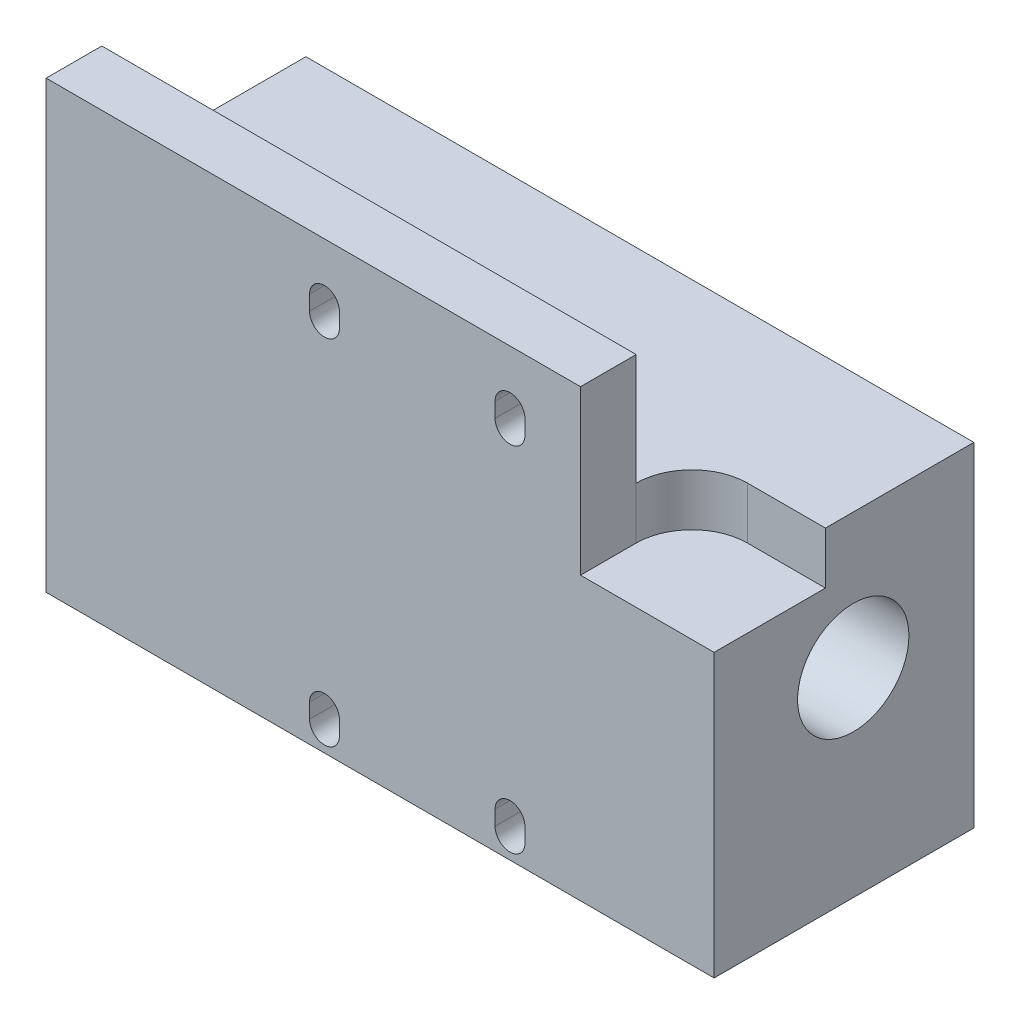
from build123d import *

# Parameters (mm, degrees)
SKETCH1_W              = 44.45
SKETCH1_H              = 76.2
BOSS_EXTRUDE1_DEPTH    = 114.3
CUT_EXTRUDE1_REACH     = 124.516
SKETCH2_R              = 9.525
SKETCH3_W              = 22.86
SKETCH3_H              = 27.94
CUT_EXTRUDE2_DEPTH     = 19.05
CUT_EXTRUDE3_REACH     = 124.516
SKETCH4_W              = 34.925
SKETCH4_H              = 19.05
FILLET1_R              = 9.525
F_10_CLEARANCE_HOLE1_D = 5.1054
CUT_EXTRUDE4_REACH     = 130.421


with BuildPart() as part:
    # Sketch1 → Boss-Extrude1 (new body)
    with BuildSketch(Plane(origin=(0, 0, 0), x_dir=(0, 0, -1), z_dir=(1, 0, 0))):
        Rectangle(SKETCH1_W, SKETCH1_H)
    extrude(amount=BOSS_EXTRUDE1_DEPTH)

    # Sketch2 → Cut-Extrude1 (cut, up to next)
    with BuildSketch(Plane(origin=(114.3, 0, 0), x_dir=(0, 0, -1), z_dir=(1, 0, 0)), mode=Mode.PRIVATE) as cut_extrude1_sk1:
        with Locations((1.588, -4.0132)):
            Circle(SKETCH2_R)
    cut_extrude1_tool1 = extrude(cut_extrude1_sk1.sketch, amount=-CUT_EXTRUDE1_REACH, mode=Mode.PRIVATE) & part.part
    add(cut_extrude1_tool1.solids().sort_by_distance((114.3, -4.0132, -1.588))[0], mode=Mode.SUBTRACT)

    # Sketch3 → Cut-Extrude2 (cut)
    with BuildSketch(Plane.XY.offset(22.225)):
        with Locations((102.87, 24.13)):
            Rectangle(SKETCH3_W, SKETCH3_H)
    extrude(amount=-CUT_EXTRUDE2_DEPTH, mode=Mode.SUBTRACT)

    # Sketch4 → Cut-Extrude3 (cut, up to next)
    with BuildSketch(Plane(origin=(0, 0, 0), x_dir=(0, 0, -1), z_dir=(1, 0, 0)), mode=Mode.PRIVATE) as cut_extrude3_sk1:
        with Locations((4.7625, 28.575)):
            Rectangle(SKETCH4_W, SKETCH4_H)
    cut_extrude3_tool1 = extrude(cut_extrude3_sk1.sketch, amount=CUT_EXTRUDE3_REACH, mode=Mode.PRIVATE) & part.part
    add(cut_extrude3_tool1.solids().sort_by_distance((0, 28.575, -4.7625))[0], mode=Mode.SUBTRACT)

    # Fillet1
    fillet1_edges = [part.edges().sort_by_distance(p)[0] for p in [
        (91.44, 14.605, 3.175),
    ]]
    fillet(fillet1_edges, radius=FILLET1_R)

    # #10 Clearance Hole1 (through all)
    with Locations(Plane(origin=(0, 0, -22.225), x_dir=(-1, 0, 0), z_dir=(0, 0, -1))):
        with Locations((-47.625, 28.6385), (-79.375, -31.8135), (-47.625, -31.8135), (-79.375, 28.6385)):
            Hole(F_10_CLEARANCE_HOLE1_D / 2)

    # Sketch9 → Cut-Extrude4 (cut, up to next)
    with BuildSketch(Plane.XY.offset(22.225), mode=Mode.PRIVATE) as cut_extrude4_sk1:
        with BuildLine():
            Line((50.1777, 28.6385), (50.1777, 26.0985))
            ThreePointArc((50.1777, 26.0985), (47.625, 23.5458), (45.0723, 26.0985))
            Line((45.0723, 26.0985), (45.0723, 28.6385))
            ThreePointArc((45.0723, 28.6385), (47.625, 31.1912), (50.1777, 28.6385))
        make_face()
    cut_extrude4_tool1 = extrude(cut_extrude4_sk1.sketch, amount=-CUT_EXTRUDE4_REACH, mode=Mode.PRIVATE) & part.part
    # Sketch9 → Cut-Extrude4 (cut, up to next)
    with BuildSketch(Plane.XY.offset(22.225), mode=Mode.PRIVATE) as cut_extrude4_sk2:
        with BuildLine():
            Line((81.9277, 28.6385), (81.9277, 26.0985))
            ThreePointArc((81.9277, 26.0985), (79.375, 23.5458), (76.8223, 26.0985))
            Line((76.8223, 26.0985), (76.8223, 28.6385))
            ThreePointArc((76.8223, 28.6385), (79.375, 31.1912), (81.9277, 28.6385))
        make_face()
    cut_extrude4_tool2 = extrude(cut_extrude4_sk2.sketch, amount=-CUT_EXTRUDE4_REACH, mode=Mode.PRIVATE) & part.part
    # Sketch9 → Cut-Extrude4 (cut, up to next)
    with BuildSketch(Plane.XY.offset(22.225), mode=Mode.PRIVATE) as cut_extrude4_sk3:
        with BuildLine():
            Line((81.9277, -31.8135), (81.9277, -34.3535))
            ThreePointArc((81.9277, -34.3535), (79.375, -36.9062), (76.8223, -34.3535))
            Line((76.8223, -34.3535), (76.8223, -31.8135))
            ThreePointArc((76.8223, -31.8135), (79.375, -29.2608), (81.9277, -31.8135))
        make_face()
    cut_extrude4_tool3 = extrude(cut_extrude4_sk3.sketch, amount=-CUT_EXTRUDE4_REACH, mode=Mode.PRIVATE) & part.part
    # Sketch9 → Cut-Extrude4 (cut, up to next)
    with BuildSketch(Plane.XY.offset(22.225), mode=Mode.PRIVATE) as cut_extrude4_sk4:
        with BuildLine():
            Line((50.1777, -31.8135), (50.1777, -34.3535))
            ThreePointArc((50.1777, -34.3535), (47.625, -36.9062), (45.0723, -34.3535))
            Line((45.0723, -34.3535), (45.0723, -31.8135))
            ThreePointArc((45.0723, -31.8135), (47.625, -29.2608), (50.1777, -31.8135))
        make_face()
    cut_extrude4_tool4 = extrude(cut_extrude4_sk4.sketch, amount=-CUT_EXTRUDE4_REACH, mode=Mode.PRIVATE) & part.part
    add(cut_extrude4_tool1.solids().sort_by_distance((47.625, 27.3685, 22.225))[0], mode=Mode.SUBTRACT)
    add(cut_extrude4_tool2.solids().sort_by_distance((79.375, 27.3685, 22.225))[0], mode=Mode.SUBTRACT)
    add(cut_extrude4_tool3.solids().sort_by_distance((79.375, -33.0835, 22.225))[0], mode=Mode.SUBTRACT)
    add(cut_extrude4_tool4.solids().sort_by_distance((47.625, -33.0835, 22.225))[0], mode=Mode.SUBTRACT)


solid = part.part
